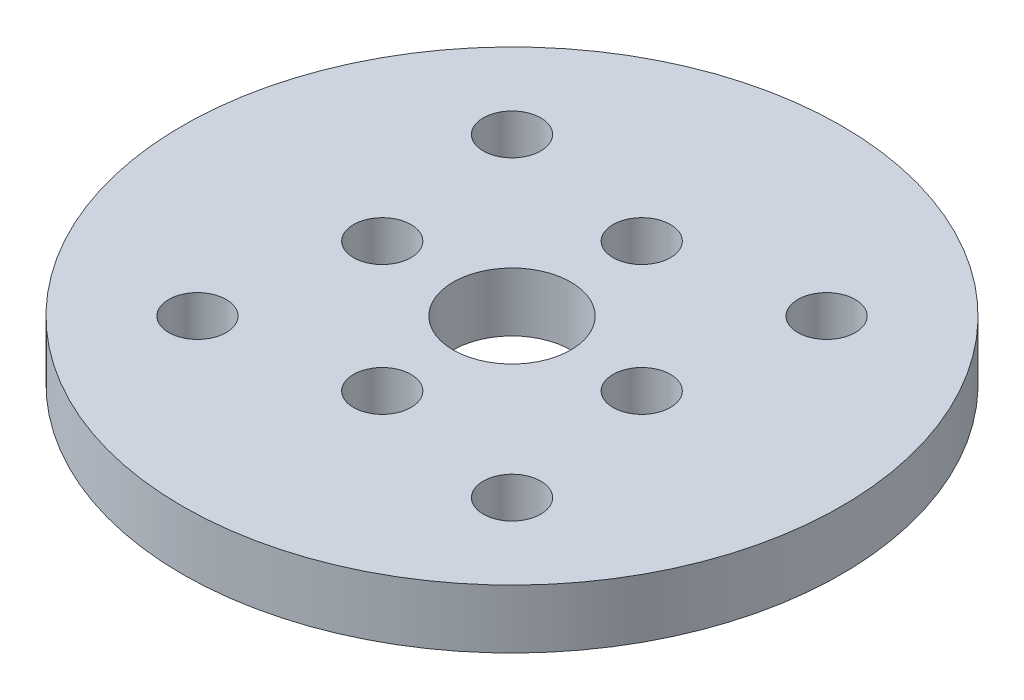
from build123d import *

# Parameters (mm, degrees)
SKETCH2_R           = 1.27
CUT_EXTRUDE1_DEPTH  = 15.69747247
SKETCH3_R           = 17.78
SKETCH3_R_2         = 3.175
SKETCH3_R_3         = 1.55
BOSS_EXTRUDE1_DEPTH = 3.175


with BuildPart() as part:
    # Sketch1 → Revolve1 (revolve)
    with BuildSketch(Plane.XY, mode=Mode.PRIVATE) as revolve1_sk:
        Polygon((4.572, 0), (4.572, 1.905), (9.906, 1.905), (9.906, 4.445), (1.397, 4.445), (1.397, 2.54), (3.175, 2.54), (3.175, 0), align=None)
    revolve(revolve1_sk.sketch.rotate(Axis((0, 0, 0), (0, 1, 0)), 90), axis=Axis((0, 0, 0), (0, 1, 0)))

    # Sketch2 → Cut-Extrude1 (cut, through all)
    with BuildSketch(Plane(origin=(0, 4.445, 0), x_dir=(1, 0, 0), z_dir=(0, 1, 0))):
        with Locations(Location((0, 7, 0), (0, 0, 270))):
            Circle(SKETCH2_R)
        with Locations(Location((7, 0, 0), (0, 0, 270))):
            Circle(SKETCH2_R)
        with Locations(Location((0, -7, 0), (0, 0, 270))):
            Circle(SKETCH2_R)
        with Locations(Location((-7, 0, 0), (0, 0, 270))):
            Circle(SKETCH2_R)
    extrude(amount=-CUT_EXTRUDE1_DEPTH, mode=Mode.SUBTRACT)


with BuildPart() as body_2:
    # Sketch3 → Boss-Extrude1 (new body)
    with BuildSketch(Plane(origin=(0, 4.445, 0), x_dir=(1, 0, 0), z_dir=(0, 1, 0))):
        with Locations(Location((0, 0, 0), (0, 0, 270))):
            Circle(SKETCH3_R)
        with Locations(Location((0, 0, 0), (0, 0, 270))):
            Circle(SKETCH3_R_2, mode=Mode.SUBTRACT)
        with Locations(Location((-8.485281374, 8.485281374, 0), (0, 0, 270))):
            Circle(SKETCH3_R_3, mode=Mode.SUBTRACT)
        with Locations(Location((0, 7, 0), (0, 0, 270))):
            Circle(SKETCH3_R_3, mode=Mode.SUBTRACT)
        with Locations(Location((7, 0, 0), (0, 0, 270))):
            Circle(SKETCH3_R_3, mode=Mode.SUBTRACT)
        with Locations(Location((0, -7, 0), (0, 0, 270))):
            Circle(SKETCH3_R_3, mode=Mode.SUBTRACT)
        with Locations(Location((-7, 0, 0), (0, 0, 270))):
            Circle(SKETCH3_R_3, mode=Mode.SUBTRACT)
        with Locations(Location((8.485281374, 8.485281374, 0), (0, 0, 270))):
            Circle(SKETCH3_R_3, mode=Mode.SUBTRACT)
        with Locations(Location((8.485281374, -8.485281374, 0), (0, 0, 270))):
            Circle(SKETCH3_R_3, mode=Mode.SUBTRACT)
        with Locations(Location((-8.485281374, -8.485281374, 0), (0, 0, 270))):
            Circle(SKETCH3_R_3, mode=Mode.SUBTRACT)
    extrude(amount=BOSS_EXTRUDE1_DEPTH)


solid = body_2.part
